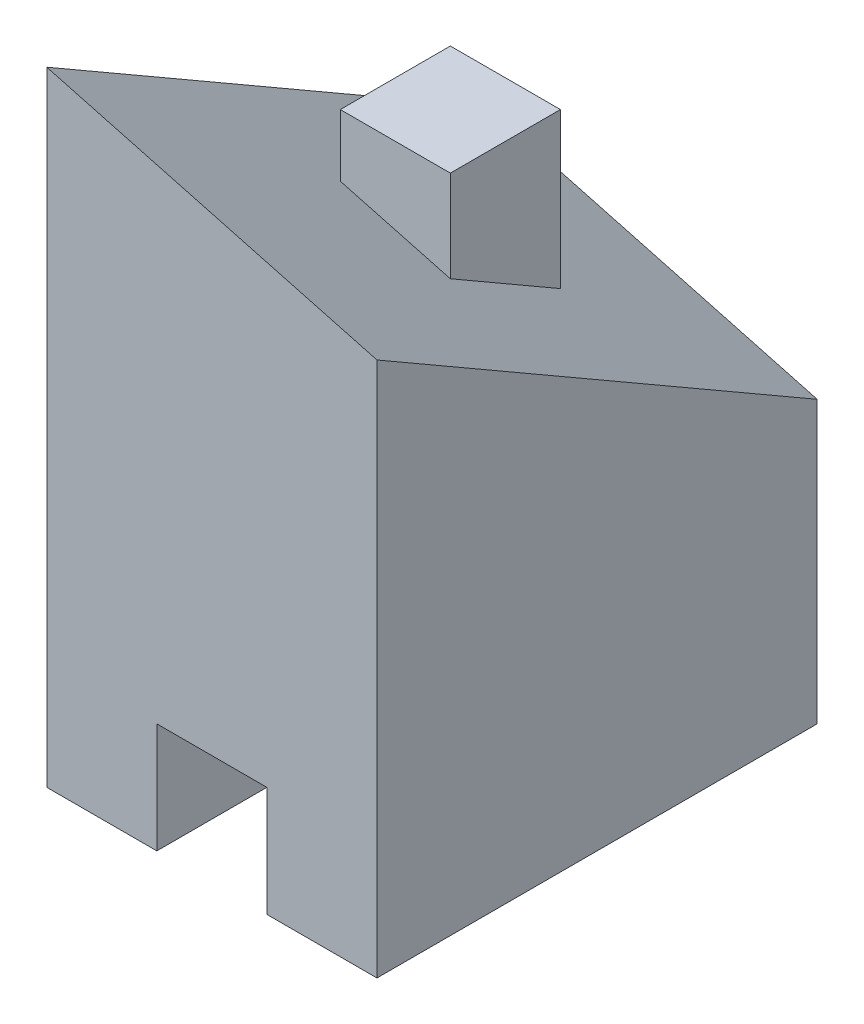
from build123d import *

# Parameters (mm, degrees)
ESBO_O1_W                = 60
ESBO_O1_H                = 85
RESSALTO_EXTRUS_O1_DEPTH = 45
CORTE_EXTRUS_O1_REACH    = 102.9
ESBO_O7_W                = 70
ESBO_O7_H                = 90
RESSALTO_EXTRUS_O2_REACH = 108.066
ESBO_O8_W                = 15
ESBO_O8_H                = 15
CORTE_EXTRUS_O2_REACH    = 115.358
ESBO_O9_W                = 15
ESBO_O9_H                = 15


with BuildPart() as part:
    # Esboço1 → Ressalto-extrusão1 (new body)
    with BuildSketch(Plane(origin=(0, 0, 0), x_dir=(0, 0, -1), z_dir=(1, 0, 0))):
        with Locations((-30, 42.5)):
            Rectangle(ESBO_O1_W, ESBO_O1_H)
    extrude(amount=RESSALTO_EXTRUS_O1_DEPTH)

    # Esboço7 → Corte-extrusão1 (cut, up to next)
    with BuildSketch(Plane(origin=(9.603131429, 35.839374403, -20.691872459), x_dir=(-0.9741169476962972, 0.19576038710152016, -0.11302231218972801), z_dir=(-0.22604462437945605, -0.8436100229619508, 0.48705847384814865)), mode=Mode.PRIVATE) as corte_extrus_o1_sk1:
        with Locations((-10.222277995, -55.295886242)):
            Rectangle(ESBO_O7_W, ESBO_O7_H)
    corte_extrus_o1_tool1 = extrude(corte_extrus_o1_sk1.sketch, amount=-CORTE_EXTRUS_O1_REACH, mode=Mode.PRIVATE) & part.part
    add(corte_extrus_o1_tool1.solids().sort_by_distance((19.560826, 61.4862, 28.351115))[0], mode=Mode.SUBTRACT)

    # Ressalto-extrusão2: up to this plane
    ressalto_extrus_o2_end = Plane(origin=(9.603131429, 35.839374403, -20.691872459), z_dir=(-0.22604462437945594, -0.8436100229619508, 0.4870584738481487))
    # Esboço8 → Ressalto-extrusão2 (add, up to the surface)
    with BuildSketch(Plane(origin=(0, 75, 0), x_dir=(1, 0, 0), z_dir=(0, 1, 0)), mode=Mode.PRIVATE) as ressalto_extrus_o2_sk1:
        with Locations((22.5, -27.5)):
            Rectangle(ESBO_O8_W, ESBO_O8_H)
    ressalto_extrus_o2_tool1 = split(extrude(ressalto_extrus_o2_sk1.sketch, amount=-RESSALTO_EXTRUS_O2_REACH, mode=Mode.PRIVATE), bisect_by=ressalto_extrus_o2_end, keep=Keep.BOTH, mode=Mode.PRIVATE)
    add(ressalto_extrus_o2_tool1.solids().sort_by_distance((22.5, 75, 27.5))[0])

    # Esboço9 → Corte-extrusão2 (cut, up to next)
    with BuildSketch(Plane(origin=(0, 0, 0), x_dir=(-1, 0, 0), z_dir=(0, 0, -1)), mode=Mode.PRIVATE) as corte_extrus_o2_sk1:
        with Locations((-22.5, 7.5)):
            Rectangle(ESBO_O9_W, ESBO_O9_H)
    corte_extrus_o2_tool1 = extrude(corte_extrus_o2_sk1.sketch, amount=-CORTE_EXTRUS_O2_REACH, mode=Mode.PRIVATE) & part.part
    add(corte_extrus_o2_tool1.solids().sort_by_distance((22.5, 7.5, 0))[0], mode=Mode.SUBTRACT)


solid = part.part
